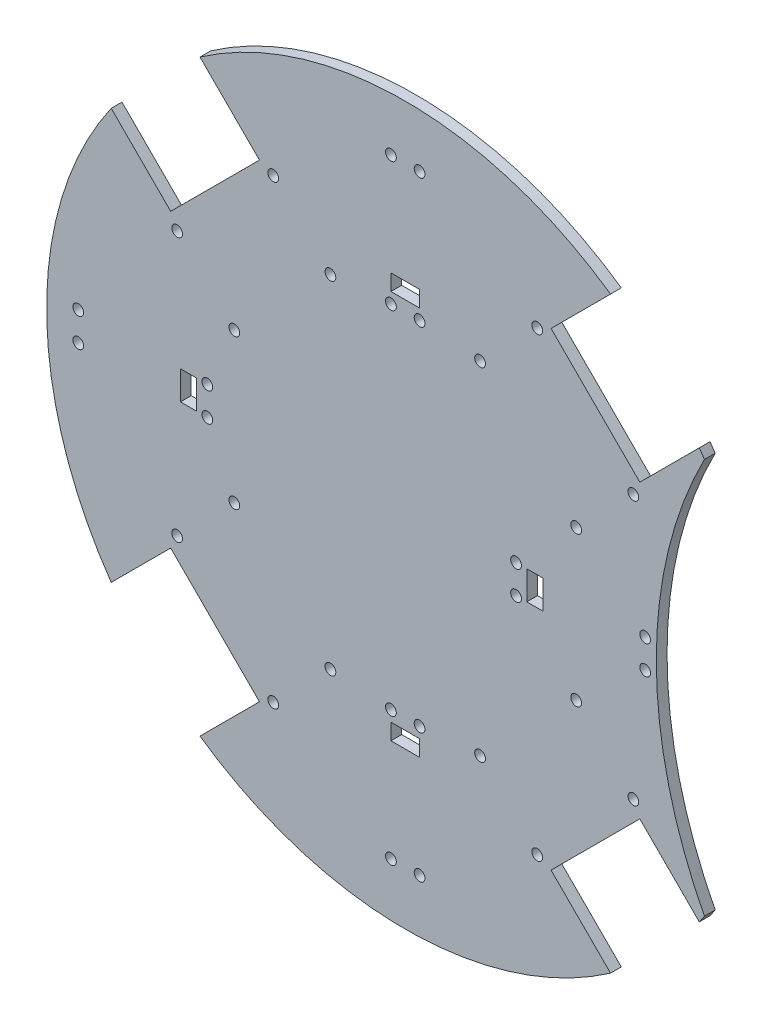
from build123d import *

# Parameters (mm, degrees)
CROQUIS1_R              = 100
SALIENTE_EXTRUIR1_DEPTH = 3
CROQUIS3_R              = 120
CORTAR_EXTRUIR1_DEPTH   = 3
CORTAR_EXTRUIR6_DEPTH   = 10
CROQUIS12_R             = 1.5
CORTAR_EXTRUIR7_DEPTH   = 142.453172464
CROQUIS9_R              = 1.5
CROQUIS9_W              = 4.5
CROQUIS9_H              = 8
CROQUIS9_W_2            = 8
CROQUIS9_H_2            = 4.5
CORTAR_EXTRUIR5_DEPTH   = 10


with BuildPart() as part:
    # Croquis1 → Saliente-Extruir1 (new body)
    with BuildSketch(Plane.XY):
        Circle(CROQUIS1_R)
    extrude(amount=SALIENTE_EXTRUIR1_DEPTH)

    # Croquis3 → Cortar-Extruir1 (cut)
    with BuildSketch(Plane.XY.offset(3)):
        with Locations((190, 0)):
            Circle(CROQUIS3_R)
    extrude(amount=-CORTAR_EXTRUIR1_DEPTH, mode=Mode.SUBTRACT)

    # Croquis5 → Cortar-Extruir6 (cut)
    with BuildSketch(Plane.XY.offset(3)):
        Polygon((-58.336309448, -83.085046789), (-83.085046789, -58.336309448), (-65.40737726, -40.658639918), (-40.658639918, -65.40737726), align=None)
        Polygon((-83.085046789, 58.336309448), (-58.336309448, 83.085046789), (-40.658639918, 65.40737726), (-65.40737726, 40.658639918), align=None)
        Polygon((58.336309448, -83.085046789), (83.085046789, -58.336309448), (65.40737726, -40.658639918), (40.658639918, -65.40737726), align=None)
        Polygon((58.336309448, 83.085046789), (83.085046789, 58.336309448), (65.40737726, 40.658639918), (40.658639918, 65.40737726), align=None)
    extrude(amount=-CORTAR_EXTRUIR6_DEPTH, mode=Mode.SUBTRACT)

    # Croquis12 → Cortar-Extruir7 (cut, through all)
    with BuildSketch(Plane.XY.offset(3)):
        with Locations((-63.604254904, -36.804908024)):
            Circle(CROQUIS12_R)
        with Locations((-36.804907897, -63.604255031)):
            Circle(CROQUIS12_R)
        with Locations((-47.666068056, -20.866721176)):
            Circle(CROQUIS12_R)
        with Locations((-20.866721049, -47.666068183)):
            Circle(CROQUIS12_R)
        with Locations(Location((47.666068183, 20.866721049, 0), (0, 0, 180))):
            Circle(CROQUIS12_R)
        with Locations(Location((20.866721176, 47.666068056, 0), (0, 0, 180))):
            Circle(CROQUIS12_R)
        with Locations(Location((63.604255031, 36.804907897, 0), (0, 0, 180))):
            Circle(CROQUIS12_R)
        with Locations(Location((36.804908024, 63.604254904, 0), (0, 0, 180))):
            Circle(CROQUIS12_R)
        with Locations((20.866721325, -47.666067908)):
            Circle(CROQUIS12_R)
        with Locations((47.666068332, -20.866720901)):
            Circle(CROQUIS12_R)
        with Locations((63.60425518, -36.804907749)):
            Circle(CROQUIS12_R)
        with Locations((36.804908173, -63.604254756)):
            Circle(CROQUIS12_R)
        with Locations(Location((-63.604254756, 36.804908173, 0), (0, 0, 180))):
            Circle(CROQUIS12_R)
        with Locations(Location((-36.804907749, 63.60425518, 0), (0, 0, 180))):
            Circle(CROQUIS12_R)
        with Locations(Location((-20.866720901, 47.666068332, 0), (0, 0, 180))):
            Circle(CROQUIS12_R)
        with Locations(Location((-47.666067908, 20.866721325, 0), (0, 0, 180))):
            Circle(CROQUIS12_R)
    extrude(amount=-CORTAR_EXTRUIR7_DEPTH, mode=Mode.SUBTRACT)

    # Croquis9 → Cortar-Extruir5 (cut)
    with BuildSketch(Plane.XY.offset(3)):
        with Locations((66.9, -4)):
            Circle(CROQUIS9_R)
        with Locations((30.9, 4)):
            Circle(CROQUIS9_R)
        with Locations((66.9, 4)):
            Circle(CROQUIS9_R)
        with Locations((30.9, -4)):
            Circle(CROQUIS9_R)
        with Locations((-91.190074744, 4)):
            Circle(CROQUIS9_R)
        with Locations((-91.190074744, -4)):
            Circle(CROQUIS9_R)
        with Locations((-55.190074744, 4)):
            Circle(CROQUIS9_R)
        with Locations((-55.190074744, -4)):
            Circle(CROQUIS9_R)
        with Locations((-4, 85)):
            Circle(CROQUIS9_R)
        with Locations((4, 85)):
            Circle(CROQUIS9_R)
        with Locations((-4, 49)):
            Circle(CROQUIS9_R)
        with Locations((4, 49)):
            Circle(CROQUIS9_R)
        with Locations((-4, -49)):
            Circle(CROQUIS9_R)
        with Locations((4, -49)):
            Circle(CROQUIS9_R)
        with Locations((4, -85)):
            Circle(CROQUIS9_R)
        with Locations((-4, -85)):
            Circle(CROQUIS9_R)
        with Locations((36.15, 0)):
            Rectangle(CROQUIS9_W, CROQUIS9_H)
        with Locations((0, -54.25)):
            Rectangle(CROQUIS9_W_2, CROQUIS9_H_2)
        with Locations((-60.440074744, 0)):
            Rectangle(CROQUIS9_W, CROQUIS9_H)
        with Locations((0, 54.25)):
            Rectangle(CROQUIS9_W_2, CROQUIS9_H_2)
    extrude(amount=-CORTAR_EXTRUIR5_DEPTH, mode=Mode.SUBTRACT)


solid = part.part
